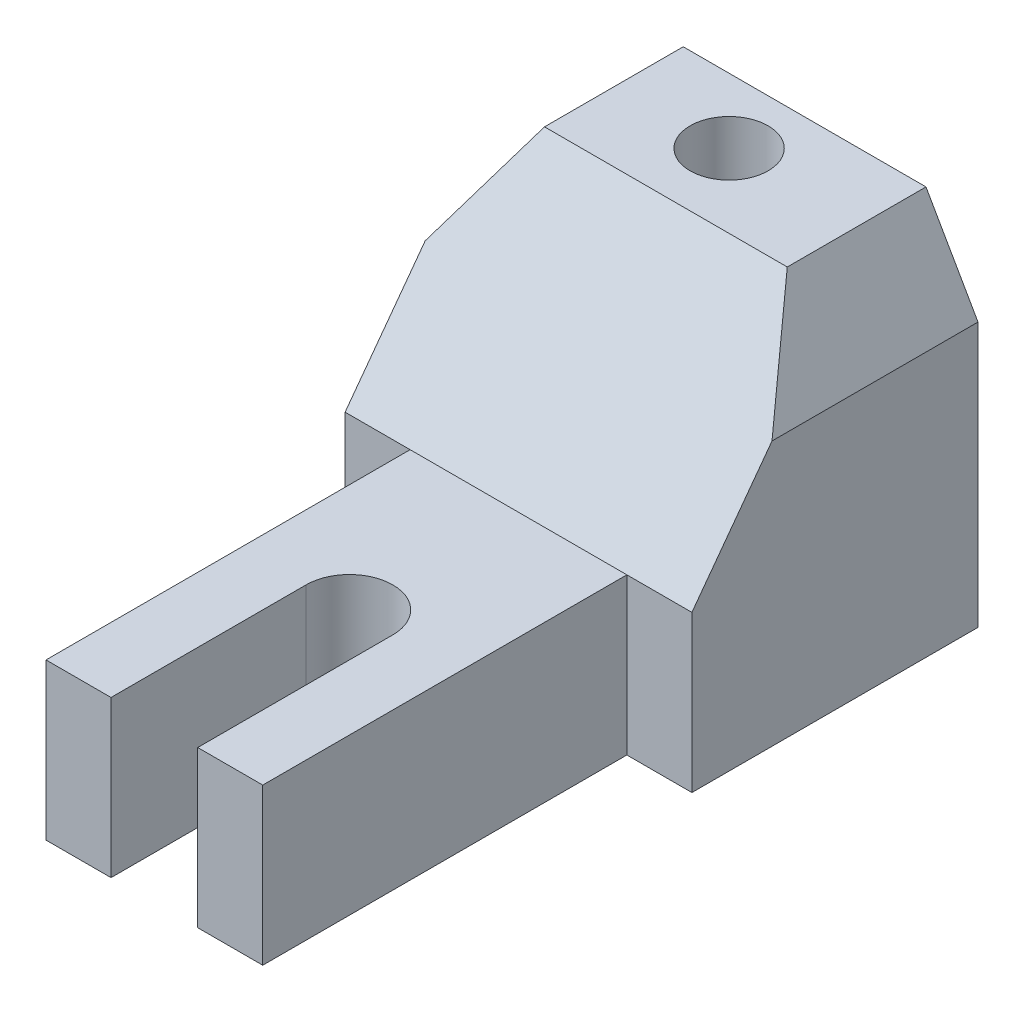
from build123d import *

# Parameters (mm, degrees)
BOSS_EXTRUDE1_DEPTH = 80
CHAMFER1_SIZE       = 12
CHAMFER1_SIZE2      = 21
CHAMFER2_SIZE       = 12
CHAMFER2_SIZE2      = 21
SKETCH2_R           = 9
CUT_EXTRUDE1_DEPTH  = 80
BOSS_EXTRUDE2_DEPTH = 36


with BuildPart() as part:
    # Sketch1 → Boss-Extrude1 (new body)
    with BuildSketch(Plane(origin=(0, 0, 0), x_dir=(0, 0, -1), z_dir=(1, 0, 0))):
        Polygon((-44.171875, 0), (-44.171875, 36), (-10.171875, 82), (21.828125, 82), (21.828125, 0), align=None)
    extrude(amount=-BOSS_EXTRUDE1_DEPTH)

    # Chamfer1
    chamfer1_edges = [part.edges().sort_by_distance(p)[0] for p in [
        (0, 82, -5.828125),
    ]]
    chamfer1_side = [part.faces().sort_by_distance(p)[0] for p in [
        (-40, 82, -5.828125),
    ]]
    chamfer(chamfer1_edges, length=CHAMFER1_SIZE, length2=CHAMFER1_SIZE2, reference=chamfer1_side[0])

    # Chamfer2
    chamfer2_edges = [part.edges().sort_by_distance(p)[0] for p in [
        (-80, 82, -5.828125),
    ]]
    chamfer2_side = [part.faces().sort_by_distance(p)[0] for p in [
        (-46, 82, -5.828125),
    ]]
    chamfer(chamfer2_edges, length=CHAMFER2_SIZE, length2=CHAMFER2_SIZE2, reference=chamfer2_side[0])

    # Sketch2 → Cut-Extrude1 (cut)
    with BuildSketch(Plane(origin=(0, 82, 0), x_dir=(1, 0, 0), z_dir=(0, 1, 0))):
        with Locations(Location((-42.415623136, 6.828125, 0), (0, 0, 270))):
            Circle(SKETCH2_R)
    extrude(amount=-CUT_EXTRUDE1_DEPTH, mode=Mode.SUBTRACT)

    # Sketch3 → Boss-Extrude2 (add)
    with BuildSketch(Plane.XZ):
        with BuildLine():
            Line((-65, 128.171875), (-65, 44.171875))
            Line((-65, 44.171875), (-15, 44.171875))
            Line((-15, 44.171875), (-15, 128.171875))
            Line((-15, 128.171875), (-30, 128.171875))
            Line((-30, 128.171875), (-30, 83.171875))
            ThreePointArc((-30, 83.171875), (-40, 73.171875), (-50, 83.171875))
            Line((-50, 83.171875), (-50, 128.171875))
            Line((-50, 128.171875), (-65, 128.171875))
        make_face()
    extrude(amount=-BOSS_EXTRUDE2_DEPTH)


solid = part.part
